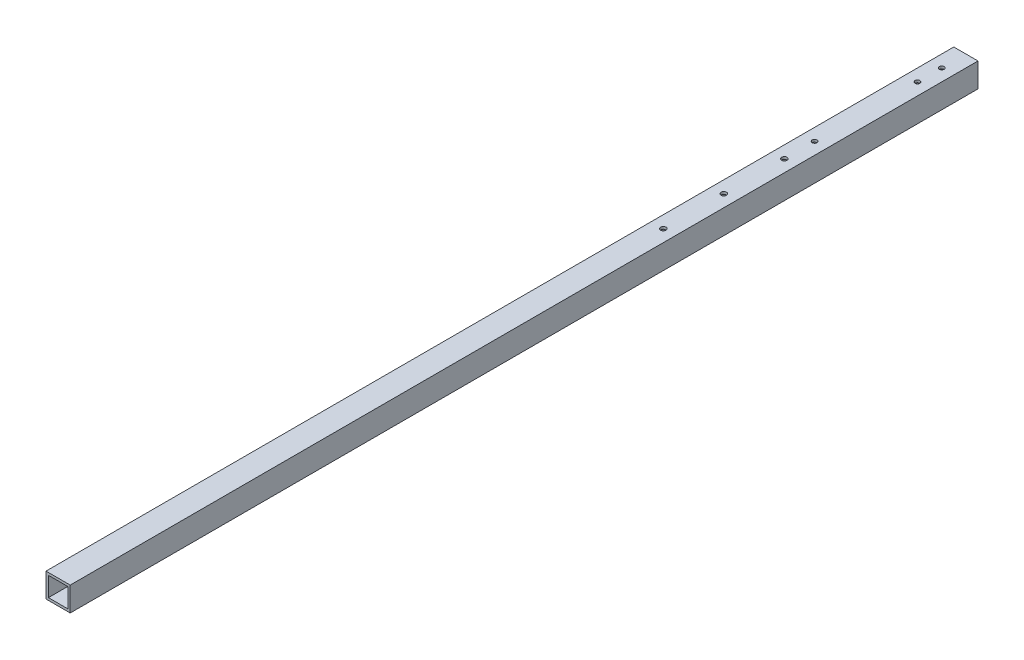
from build123d import *

# Parameters (mm, degrees)
SKETCH_1_W          = 20
SKETCH_1_H          = 20
SKETCH_1_W_2        = 16
SKETCH_1_H_2        = 16
EXTRUDE_1_DEPTH     = 375
SKETCH_2_R          = 2
CUT_EXTRUDE_1_DEPTH = 376.666075125
SKETCH_3_R          = 2.25
CUT_EXTRUDE_2_DEPTH = 376.666075125


with BuildPart() as part:
    # 草图1 → 凸台-拉伸1 (new, symmetric)
    with BuildSketch(Plane.XY):
        Rectangle(SKETCH_1_W, SKETCH_1_H)
        Rectangle(SKETCH_1_W_2, SKETCH_1_H_2, mode=Mode.SUBTRACT)
    extrude(amount=EXTRUDE_1_DEPTH, both=True)

    # 草图2 → 切除-拉伸1 (cut, through all)
    with BuildSketch(Plane(origin=(0, 10, 0), x_dir=(1, 0, 0), z_dir=(0, 1, 0))):
        with Locations((0, 385)):
            Circle(SKETCH_2_R)
        with Locations(Location((0, 355, 0), (0, 0, 180))):
            Circle(SKETCH_2_R)
        with Locations(Location((0, 250, 0), (0, 0, 180))):
            Circle(SKETCH_2_R)
        with Locations(Location((0, 335, 0), (0, 0, 180))):
            Circle(SKETCH_2_R)
    extrude(amount=-CUT_EXTRUDE_1_DEPTH, mode=Mode.SUBTRACT)

    # 草图3 → 切除-拉伸2 (cut, through all)
    with BuildSketch(Plane(origin=(0, 10, 0), x_dir=(1, 0, 0), z_dir=(0, 1, 0))):
        with Locations(Location((0, 125, 0), (0, 0, 180))):
            Circle(SKETCH_3_R)
        with Locations(Location((0, 175, 0), (0, 0, 180))):
            Circle(SKETCH_3_R)
        with Locations(Location((0, 225, 0), (0, 0, 180))):
            Circle(SKETCH_3_R)
    extrude(amount=-CUT_EXTRUDE_2_DEPTH, mode=Mode.SUBTRACT)


solid = part.part
